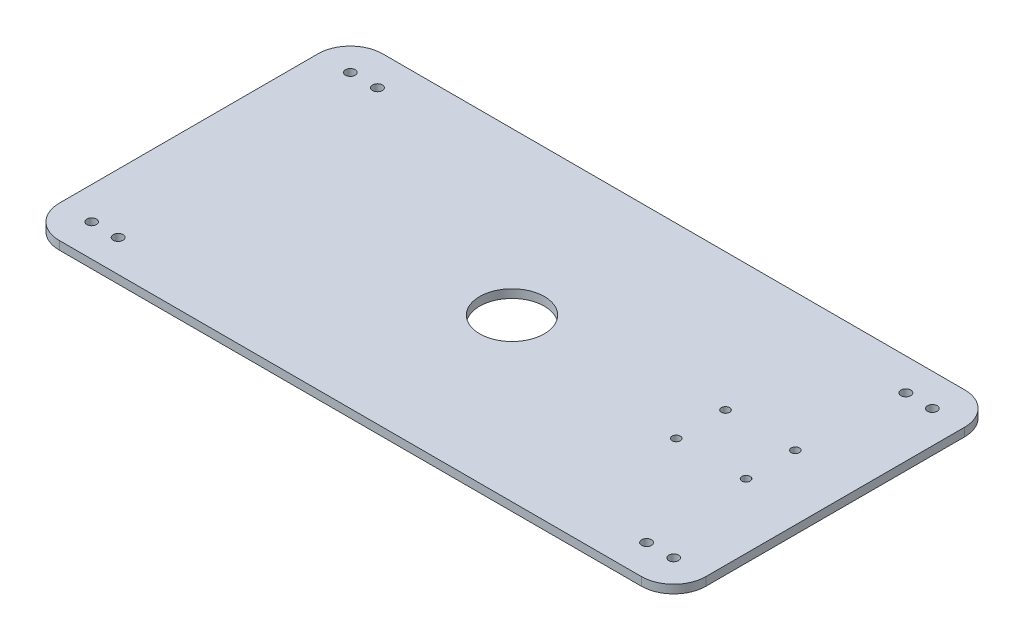
from build123d import *

# Parameters (mm, degrees)
SKETCH1_W               = 200
SKETCH1_H               = 100
BOSS_EXTRUDE1_DEPTH     = 2.6
FILLET1_R               = 10
SKETCH6_R               = 1.5
CUT_EXTRUDE6_DEPTH      = 2.6
MIRROR6_COPY_1_SKETCH_R = 1.5
MIRROR6_COPY_1_DEPTH    = 2.6
SKETCH15_R              = 10
CUT_EXTRUDE14_DEPTH     = 224.621913059
SKETCH20_R              = 1.27
CUT_EXTRUDE15_DEPTH     = 224.621913059
SKETCH23_R              = 1.524
CUT_EXTRUDE16_DEPTH     = 2.59999988
MIRROR8_COPY_1_SKETCH_R = 1.524
MIRROR8_COPY_1_DEPTH    = 2.59999988


with BuildPart() as part:
    # Sketch1 → Boss-Extrude1 (new body)
    with BuildSketch(Plane(origin=(0, 0, 0), x_dir=(1, 0, 0), z_dir=(0, 1, 0))):
        with Locations((100, -50)):
            Rectangle(SKETCH1_W, SKETCH1_H)
    extrude(amount=BOSS_EXTRUDE1_DEPTH)

    # Fillet1
    fillet1_edges = [part.edges().sort_by_distance(p)[0] for p in [
        (0, 1.3, 0),
        (200, 1.3, 0),
        (200, 1.3, 100),
        (0, 1.3, 100),
    ]]
    fillet(fillet1_edges, radius=FILLET1_R)

    # Sketch6 → Cut-Extrude6 (cut)
    with BuildSketch(Plane.XZ):
        with Locations(Location((190, 10, 0), (0, 0, 270))):
            Circle(SKETCH6_R)
    cut_extrude6 = extrude(amount=-CUT_EXTRUDE6_DEPTH, mode=Mode.SUBTRACT)

    # Mirror5: Cut-Extrude6 across plane
    add(cut_extrude6.mirror(Plane(origin=(100, 0, 0), x_dir=(0, 0, 1), z_dir=(1, 0, 0))), mode=Mode.SUBTRACT)

    # Mirror6: Cut-Extrude6 across plane
    add(cut_extrude6.mirror(Plane.XY.offset(50)), mode=Mode.SUBTRACT)

    # Mirror6 copy 1 sketch → Mirror6 copy 1 (cut)
    with BuildSketch(Plane(origin=(200, 0, 100), x_dir=(-1, 0, 0), z_dir=(0, -1, 0))):
        with Locations(Location((190, 10, 0), (0, 0, 270))):
            Circle(MIRROR6_COPY_1_SKETCH_R)
    extrude(amount=-MIRROR6_COPY_1_DEPTH, mode=Mode.SUBTRACT)

    # Sketch15 → Cut-Extrude14 (cut, through all)
    with BuildSketch(Plane.XZ):
        with Locations(Location((100, 50, 0), (0, 0, 270))):
            Circle(SKETCH15_R)
    extrude(amount=-CUT_EXTRUDE14_DEPTH, mode=Mode.SUBTRACT)

    # Sketch20 → Cut-Extrude15 (cut, through all)
    with BuildSketch(Plane(origin=(0, 2.6, 0), x_dir=(1, 0, 0), z_dir=(0, 1, 0))):
        with Locations(Location((158.41, -42.38, 0), (0, 0, 270))):
            Circle(SKETCH20_R)
        with Locations(Location((180, -42.38, 0), (0, 0, 270))):
            Circle(SKETCH20_R)
        with Locations(Location((158.41, -57.62, 0), (0, 0, 270))):
            Circle(SKETCH20_R)
        with Locations(Location((180, -57.62, 0), (0, 0, 270))):
            Circle(SKETCH20_R)
    extrude(amount=-CUT_EXTRUDE15_DEPTH, mode=Mode.SUBTRACT)

    # Sketch23 → Cut-Extrude16 (cut)
    with BuildSketch(Plane(origin=(0, 2.6, 0), x_dir=(1, 0, 0), z_dir=(0, 1, 0))):
        with Locations(Location((18.288, -9.906, 0), (0, 0, 270))):
            Circle(SKETCH23_R)
    cut_extrude16 = extrude(amount=-CUT_EXTRUDE16_DEPTH, mode=Mode.SUBTRACT)

    # Mirror7: Cut-Extrude16 across plane
    add(cut_extrude16.mirror(Plane(origin=(100, 0, 0), x_dir=(0, 0, 1), z_dir=(1, 0, 0))), mode=Mode.SUBTRACT)

    # Mirror8: Cut-Extrude16 across plane
    add(cut_extrude16.mirror(Plane.XY.offset(50)), mode=Mode.SUBTRACT)

    # Mirror8 copy 1 sketch → Mirror8 copy 1 (cut)
    with BuildSketch(Plane(origin=(200, 2.6, 100), x_dir=(-1, 0, 0), z_dir=(0, 1, 0))):
        with Locations(Location((18.288, -9.906, 0), (0, 0, 270))):
            Circle(MIRROR8_COPY_1_SKETCH_R)
    extrude(amount=-MIRROR8_COPY_1_DEPTH, mode=Mode.SUBTRACT)


solid = part.part
